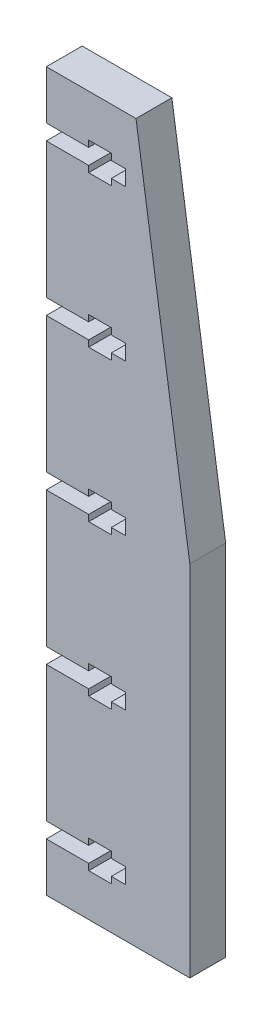
from build123d import *

# Parameters (mm, degrees)
SKETCH1_W               = 6.35
SKETCH1_H               = 127
BOSS_EXTRUDE1_DEPTH     = 25.4
CUT_EXTRUDE1_DEPTH      = 69.685751798
CUT_EXTRUDE1_DEPTH_BACK = 69.685751798


with BuildPart() as part:
    # Sketch1 → Boss-Extrude1 (new body)
    with BuildSketch(Plane(origin=(0, 0, 0), x_dir=(0, 0, -1), z_dir=(1, 0, 0))):
        Rectangle(SKETCH1_W, SKETCH1_H)
    extrude(amount=BOSS_EXTRUDE1_DEPTH)

    # Sketch4 → Cut-Extrude1 (cut, two sides: drawn at the far end of the back side and taken through both)
    with BuildSketch(Plane.XY.offset(3.175).offset(-CUT_EXTRUDE1_DEPTH_BACK)):
        Polygon((7.5, 54.875), (0, 54.875), (0, 52.125), (7.5, 52.125), (7.5, 51), (11.5, 51), (11.5, 52.125), (14, 52.125), (14, 54.875), (11.5, 54.875), (11.5, 56), (7.5, 56), align=None)
        Polygon((25.4, 63.5), (15.875, 63.5), (25.4, 0), align=None)
        Polygon((7.5, 28.125), (0, 28.125), (0, 25.375), (7.5, 25.375), (7.5, 24.25), (11.5, 24.25), (11.5, 25.375), (14, 25.375), (14, 28.125), (11.5, 28.125), (11.5, 29.25), (7.5, 29.25), align=None)
        Polygon((7.5, 1.375), (0, 1.375), (0, -1.375), (7.5, -1.375), (7.5, -2.5), (11.5, -2.5), (11.5, -1.375), (14, -1.375), (14, 1.375), (11.5, 1.375), (11.5, 2.5), (7.5, 2.5), align=None)
        Polygon((7.5, -25.375), (0, -25.375), (0, -28.125), (7.5, -28.125), (7.5, -29.25), (11.5, -29.25), (11.5, -28.125), (14, -28.125), (14, -25.375), (11.5, -25.375), (11.5, -24.25), (7.5, -24.25), align=None)
        Polygon((7.5, -52.125), (0, -52.125), (0, -54.875), (7.5, -54.875), (7.5, -56), (11.5, -56), (11.5, -54.875), (14, -54.875), (14, -52.125), (11.5, -52.125), (11.5, -51), (7.5, -51), align=None)
    extrude(amount=CUT_EXTRUDE1_DEPTH + CUT_EXTRUDE1_DEPTH_BACK, mode=Mode.SUBTRACT)


solid = part.part
